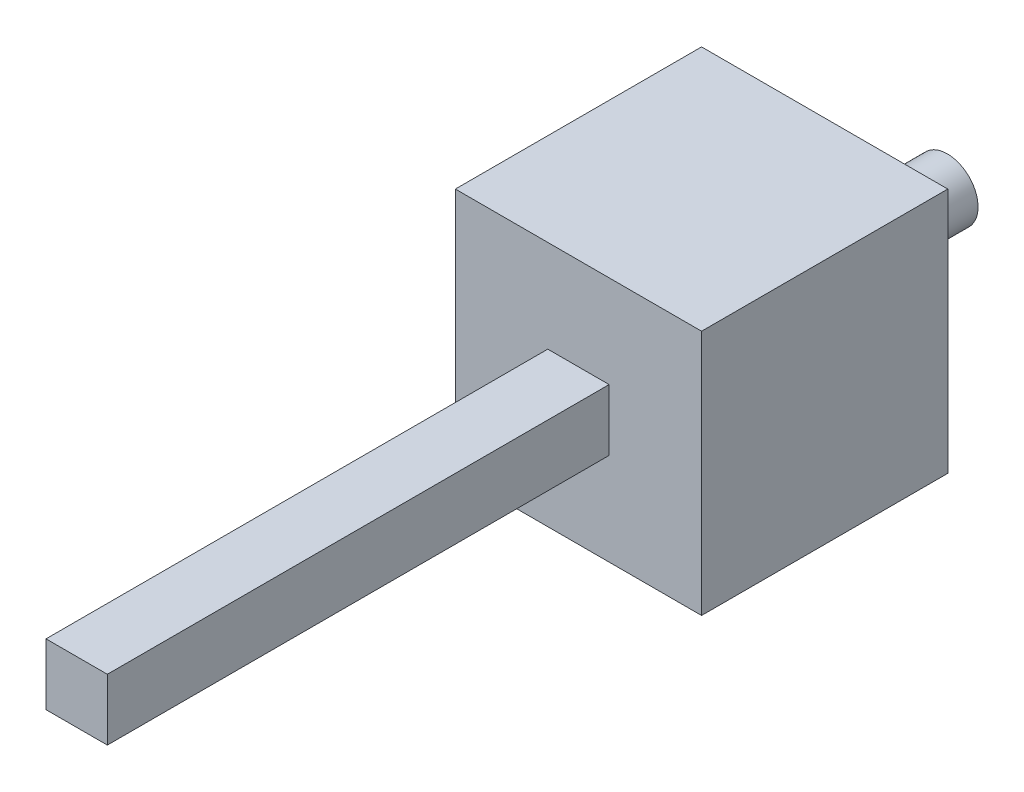
from build123d import *

# Parameters (mm, degrees)
CROQUIS1_W              = 2.0066
CROQUIS1_H              = 2.0066
SALIENTE_EXTRUIR1_DEPTH = 2.0066
CROQUIS3_W              = 0.5
CROQUIS3_H              = 0.5
SALIENTE_EXTRUIR3_DEPTH = 6.096
CROQUIS4_R              = 0.25
SALIENTE_EXTRUIR4_DEPTH = 1


with BuildPart() as part:
    # Croquis1 → Saliente-Extruir1 (new body)
    with BuildSketch(Plane.XY):
        Rectangle(CROQUIS1_W, CROQUIS1_H)
    extrude(amount=SALIENTE_EXTRUIR1_DEPTH)

    # Croquis3 → Saliente-Extruir3 (add)
    with BuildSketch(Plane(origin=(0, 0, 0), x_dir=(-1, 0, 0), z_dir=(0, 0, -1))):
        Rectangle(CROQUIS3_W, CROQUIS3_H)
    extrude(amount=-SALIENTE_EXTRUIR3_DEPTH)

    # Croquis4 → Saliente-Extruir4 (add)
    with BuildSketch(Plane(origin=(0, 0, 0), x_dir=(-1, 0, 0), z_dir=(0, 0, -1))):
        Circle(CROQUIS4_R)
    extrude(amount=SALIENTE_EXTRUIR4_DEPTH)


solid = part.part
